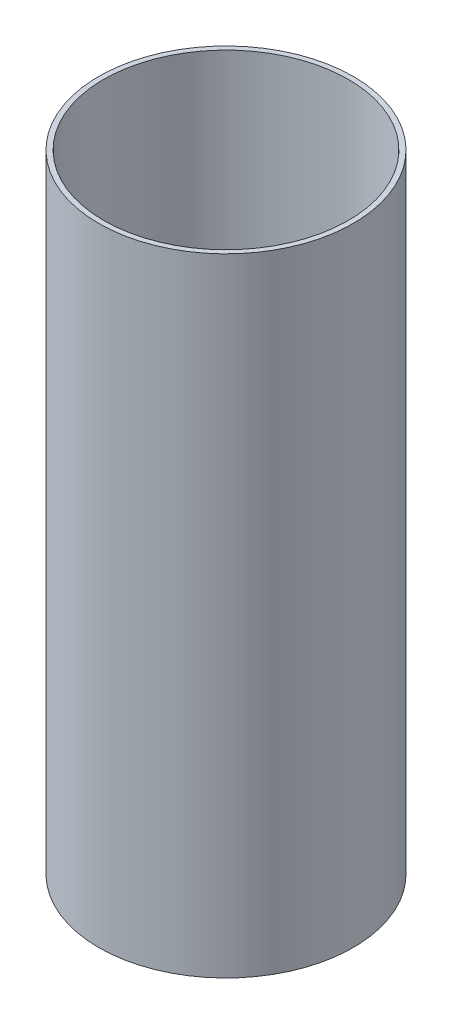
from build123d import *

# Parameters (mm, degrees)
SKETCH1_R           = 51.562
SKETCH1_R_2         = 49.53
BOSS_EXTRUDE1_DEPTH = 254


with BuildPart() as part:
    # Sketch1 → Boss-Extrude1 (new body)
    with BuildSketch(Plane(origin=(0, 0, 0), x_dir=(1, 0, 0), z_dir=(0, 1, 0))):
        with Locations(Location((0, 0, 0), (0, 0, 270))):
            Circle(SKETCH1_R)
        with Locations(Location((0, 0, 0), (0, 0, 270))):
            Circle(SKETCH1_R_2, mode=Mode.SUBTRACT)
    extrude(amount=BOSS_EXTRUDE1_DEPTH)


solid = part.part
